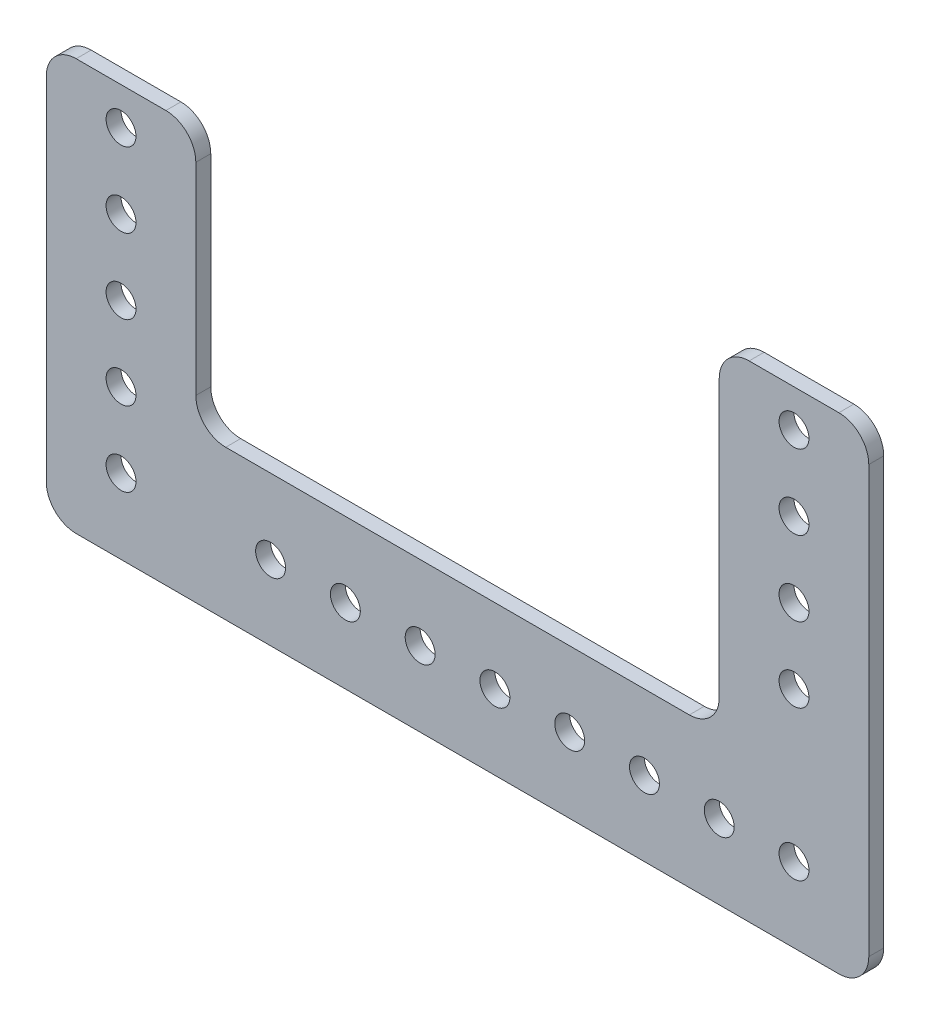
from build123d import *

# Parameters (mm, degrees)
SKETCH2_R           = 2.54
BOSS_EXTRUDE1_DEPTH = 2.54


with BuildPart() as part:
    # Sketch2 → Boss-Extrude1 (new body)
    with BuildSketch(Plane.XY):
        with BuildLine():
            Line((317.5, 62.23), (317.5, 121.92))
            ThreePointArc((317.5, 121.92), (318.987897552, 125.512102448), (322.58, 127))
            Line((322.58, 127), (337.82, 127))
            ThreePointArc((337.82, 127), (341.412102448, 125.512102448), (342.9, 121.92))
            Line((342.9, 121.92), (342.9, 87.63))
            ThreePointArc((342.9, 87.63), (344.387897552, 84.037897552), (347.98, 82.55))
            Line((347.98, 82.55), (426.72, 82.55))
            ThreePointArc((426.72, 82.55), (430.312102448, 84.037897552), (431.8, 87.63))
            Line((431.8, 87.63), (431.8, 134.62))
            ThreePointArc((431.8, 134.62), (433.287897552, 138.212102448), (436.88, 139.7))
            Line((436.88, 139.7), (452.12, 139.7))
            ThreePointArc((452.12, 139.7), (455.712102448, 138.212102448), (457.2, 134.62))
            Line((457.2, 134.62), (457.2, 82.55))
            Line((457.2, 82.55), (457.2, 62.23))
            ThreePointArc((457.2, 62.23), (455.712102448, 58.637897552), (452.12, 57.15))
            Line((452.12, 57.15), (322.58, 57.15))
            ThreePointArc((322.58, 57.15), (318.987897552, 58.637897552), (317.5, 62.23))
        make_face()
        with Locations((444.5, 133.35)):
            Circle(SKETCH2_R, mode=Mode.SUBTRACT)
        with Locations((444.5, 120.65)):
            Circle(SKETCH2_R, mode=Mode.SUBTRACT)
        with Locations((444.5, 107.95)):
            Circle(SKETCH2_R, mode=Mode.SUBTRACT)
        with Locations((444.5, 95.25)):
            Circle(SKETCH2_R, mode=Mode.SUBTRACT)
        with Locations((444.5, 69.85)):
            Circle(SKETCH2_R, mode=Mode.SUBTRACT)
        with Locations((431.8, 69.85)):
            Circle(SKETCH2_R, mode=Mode.SUBTRACT)
        with Locations((419.1, 69.85)):
            Circle(SKETCH2_R, mode=Mode.SUBTRACT)
        with Locations((406.4, 69.85)):
            Circle(SKETCH2_R, mode=Mode.SUBTRACT)
        with Locations((393.7, 69.85)):
            Circle(SKETCH2_R, mode=Mode.SUBTRACT)
        with Locations((381, 69.85)):
            Circle(SKETCH2_R, mode=Mode.SUBTRACT)
        with Locations((368.3, 69.85)):
            Circle(SKETCH2_R, mode=Mode.SUBTRACT)
        with Locations((355.6, 69.85)):
            Circle(SKETCH2_R, mode=Mode.SUBTRACT)
        with Locations((330.2, 69.85)):
            Circle(SKETCH2_R, mode=Mode.SUBTRACT)
        with Locations((330.2, 82.55)):
            Circle(SKETCH2_R, mode=Mode.SUBTRACT)
        with Locations((330.2, 95.25)):
            Circle(SKETCH2_R, mode=Mode.SUBTRACT)
        with Locations((330.2, 107.95)):
            Circle(SKETCH2_R, mode=Mode.SUBTRACT)
        with Locations((330.2, 120.65)):
            Circle(SKETCH2_R, mode=Mode.SUBTRACT)
    extrude(amount=BOSS_EXTRUDE1_DEPTH)


solid = part.part
